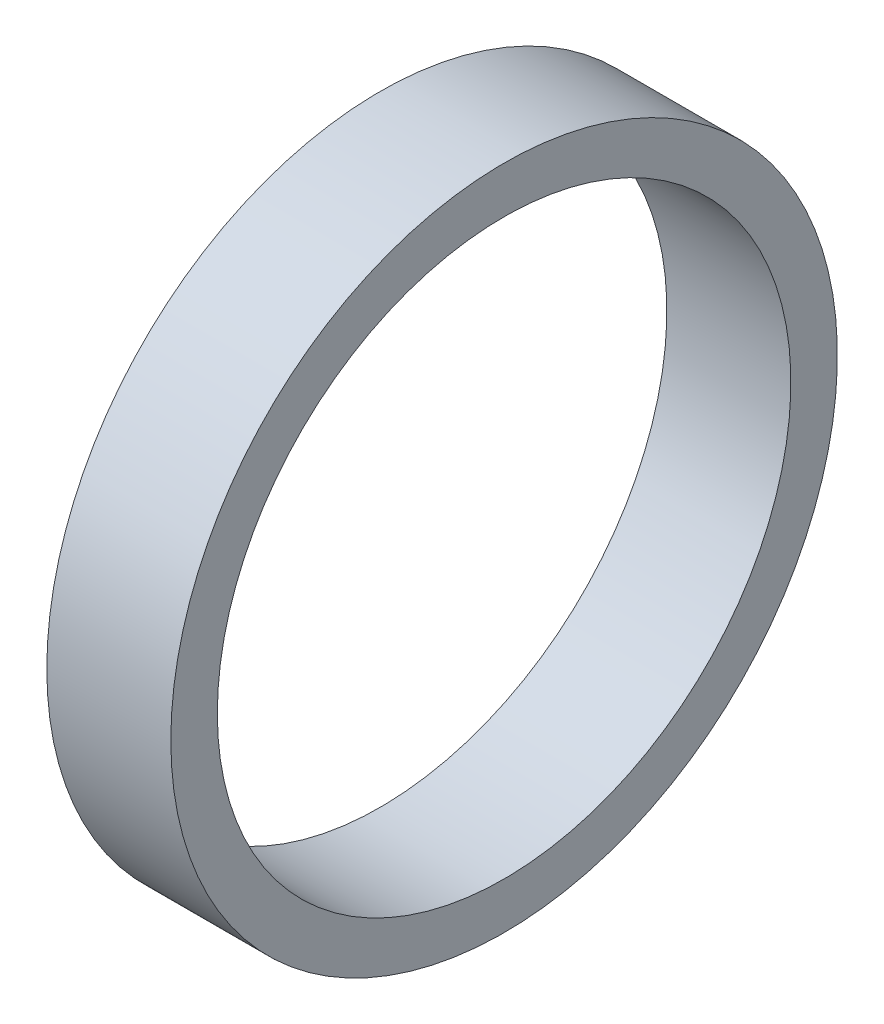
from build123d import *

# Parameters (mm, degrees)
AXIAL_PROFILE_MM_W = 4.8
AXIAL_PROFILE_MM_H = 1.8


with BuildPart() as part:
    # Axial profile (mm) → Full revolution (revolve)
    with BuildSketch(Plane.XY, mode=Mode.PRIVATE) as full_revolution_sk:
        with Locations((0, 12)):
            Rectangle(AXIAL_PROFILE_MM_W, AXIAL_PROFILE_MM_H)
    revolve(full_revolution_sk.sketch.rotate(Axis((-110, 0, 0), (1, 0, 0)), 90), axis=Axis((-110, 0, 0), (1, 0, 0)))


solid = part.part
